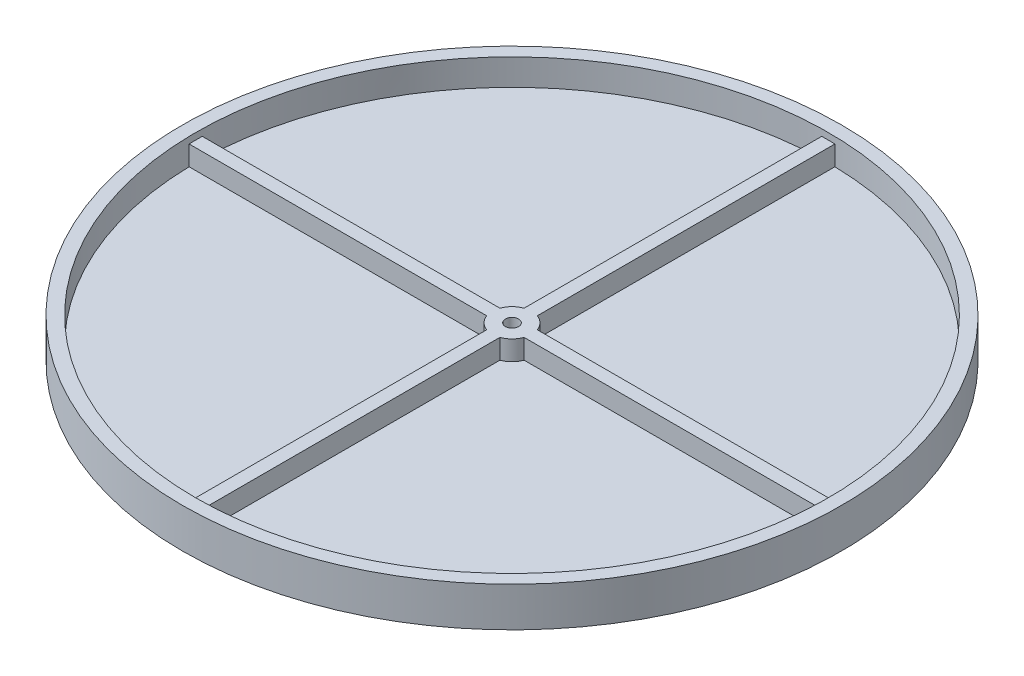
from build123d import *

# Parameters (mm, degrees)
CROQUIS1_R              = 250
SALIENTE_EXTRUIR1_DEPTH = 10
CROQUIS2_R              = 250
CROQUIS2_R_2            = 240
SALIENTE_EXTRUIR2_DEPTH = 20
CROQUIS3_R              = 15
SALIENTE_EXTRUIR3_DEPTH = 15
CROQUIS4_R              = 5
CORTAR_EXTRUIR1_DEPTH   = 355.436171969
CROQUIS5_W              = 235.044023843
CROQUIS5_H              = 10
CROQUIS5_W_2            = 10
CROQUIS5_H_2            = 235.044023843
SALIENTE_EXTRUIR4_DEPTH = 15


with BuildPart() as part:
    # Croquis1 → Saliente-Extruir1 (new body)
    with BuildSketch(Plane(origin=(0, 0, 0), x_dir=(1, 0, 0), z_dir=(0, 1, 0))):
        with Locations(Location((0, 0, 0), (0, 0, 270))):
            Circle(CROQUIS1_R)
    extrude(amount=SALIENTE_EXTRUIR1_DEPTH)

    # Croquis2 → Saliente-Extruir2 (add)
    with BuildSketch(Plane(origin=(0, 10, 0), x_dir=(1, 0, 0), z_dir=(0, 1, 0))):
        with Locations(Location((0, 0, 0), (0, 0, 270))):
            Circle(CROQUIS2_R)
        with Locations(Location((0, 0, 0), (0, 0, 270))):
            Circle(CROQUIS2_R_2, mode=Mode.SUBTRACT)
    extrude(amount=SALIENTE_EXTRUIR2_DEPTH)

    # Croquis3 → Saliente-Extruir3 (add)
    with BuildSketch(Plane(origin=(0, 10, 0), x_dir=(1, 0, 0), z_dir=(0, 1, 0))):
        with Locations(Location((0, 0, 0), (0, 0, 270))):
            Circle(CROQUIS3_R)
    extrude(amount=SALIENTE_EXTRUIR3_DEPTH)

    # Croquis4 → Cortar-Extruir1 (cut, through all)
    with BuildSketch(Plane(origin=(0, 25, 0), x_dir=(1, 0, 0), z_dir=(0, 1, 0))):
        with Locations(Location((0, 0, 0), (0, 0, 270))):
            Circle(CROQUIS4_R)
    extrude(amount=-CORTAR_EXTRUIR1_DEPTH, mode=Mode.SUBTRACT)

    # Croquis5 → Saliente-Extruir4 (add)
    with BuildSketch(Plane(origin=(0, 10, 0), x_dir=(1, 0, 0), z_dir=(0, 1, 0))):
        with Locations((126.662657579, 0)):
            Rectangle(CROQUIS5_W, CROQUIS5_H)
        with Locations((0, -126.662657579)):
            Rectangle(CROQUIS5_W_2, CROQUIS5_H_2)
        with Locations((-126.662657579, 0)):
            Rectangle(CROQUIS5_W, CROQUIS5_H)
        with Locations((0, 126.662657579)):
            Rectangle(CROQUIS5_W_2, CROQUIS5_H_2)
    extrude(amount=SALIENTE_EXTRUIR4_DEPTH)


solid = part.part
